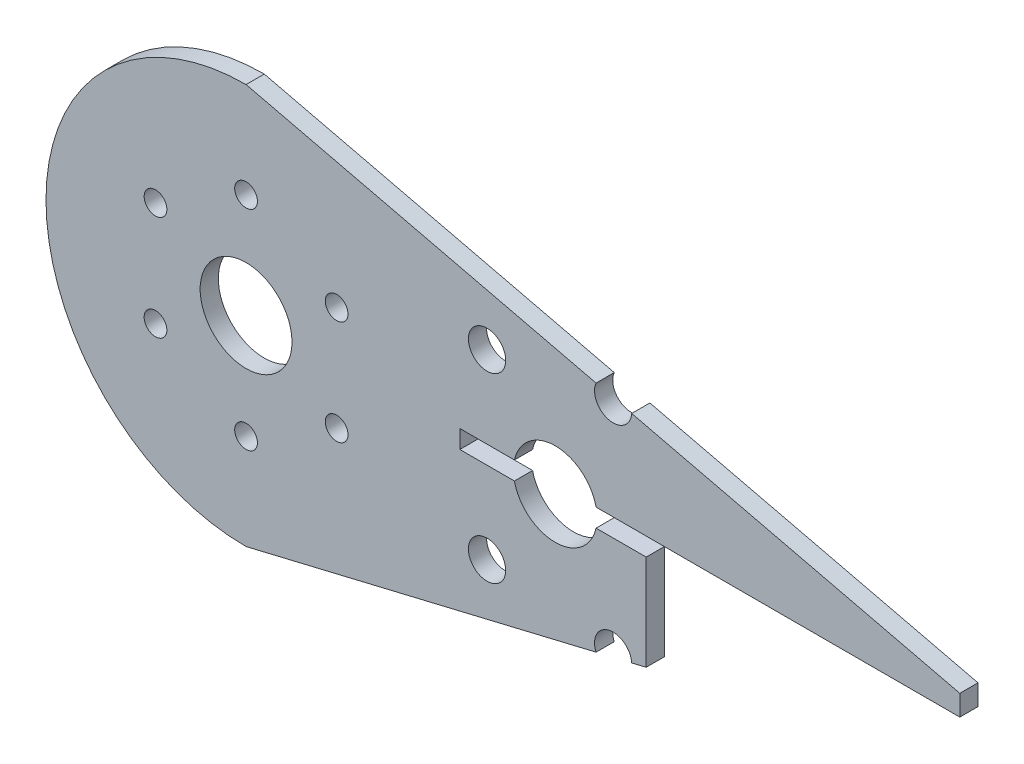
from build123d import *

# Parameters (mm, degrees)
SKETCH_1_R      = 5.05
SKETCH_1_R_2    = 1.25
SKETCH_1_R_3    = 2.05
EXTRUDE_1_DEPTH = 2


with BuildPart() as part:
    # 草图1 → 凸台-拉伸1 (new body)
    with BuildSketch(Plane.XY):
        with BuildLine():
            Line((-15.488984032, 1), (-9.488984032, 1))
            ThreePointArc((-9.488984032, 1), (-4.998995168, 4.6), (-0.509006304, 1))
            Line((-0.509006304, 1), (5.001004832, 1))
            Line((5.001004832, 1), (39.492739898, 1))
            Line((39.492739898, 1), (39.492739898, 3.269234909))
            Line((39.492739898, 3.269234909), (5.001004832, 11.501004832))
            Line((5.001004832, 11.501004832), (3.407723631, 11.881256049))
            ThreePointArc((3.407723631, 11.881256049), (0.892865212, 10.016888454), (-0.509006304, 12.816019685))
            Line((-0.509006304, 12.816019685), (-38.998995168, 22.002009663))
            ThreePointArc((-38.998995168, 22.002009663), (-61.001004832, 0), (-38.998995168, -22.002009663))
            Line((-38.998995168, -22.002009663), (-0.509006304, -12.816019685))
            ThreePointArc((-0.509006304, -12.816019685), (0.892865212, -10.016888454), (3.407723631, -11.881256049))
            Line((3.407723631, -11.881256049), (5.001004832, -11.501004832))
            Line((5.001004832, -11.501004832), (5.001004832, -1))
            Line((5.001004832, -1), (-0.509006304, -1))
            ThreePointArc((-0.509006304, -1), (-4.998995168, -4.6), (-9.488984032, -1))
            Line((-9.488984032, -1), (-15.488984032, -1))
            Line((-15.488984032, -1), (-15.488984032, 1))
        make_face()
        with Locations((-38.998995168, 0)):
            Circle(SKETCH_1_R, mode=Mode.SUBTRACT)
        with Locations((-38.998995168, -11.5)):
            Circle(SKETCH_1_R_2, mode=Mode.SUBTRACT)
        with Locations((-12.498995168, -10)):
            Circle(SKETCH_1_R_3, mode=Mode.SUBTRACT)
        with Locations((-48.958287312, -5.75)):
            Circle(SKETCH_1_R_2, mode=Mode.SUBTRACT)
        with Locations(Location((-12.498995168, 10, 0), (0, 0, 180))):
            Circle(SKETCH_1_R_3, mode=Mode.SUBTRACT)
        with Locations((-48.958287312, 5.75)):
            Circle(SKETCH_1_R_2, mode=Mode.SUBTRACT)
        with Locations((-38.998995168, 11.5)):
            Circle(SKETCH_1_R_2, mode=Mode.SUBTRACT)
        with Locations((-29.039703025, 5.75)):
            Circle(SKETCH_1_R_2, mode=Mode.SUBTRACT)
        with Locations((-29.039703025, -5.75)):
            Circle(SKETCH_1_R_2, mode=Mode.SUBTRACT)
    extrude(amount=EXTRUDE_1_DEPTH)


solid = part.part
